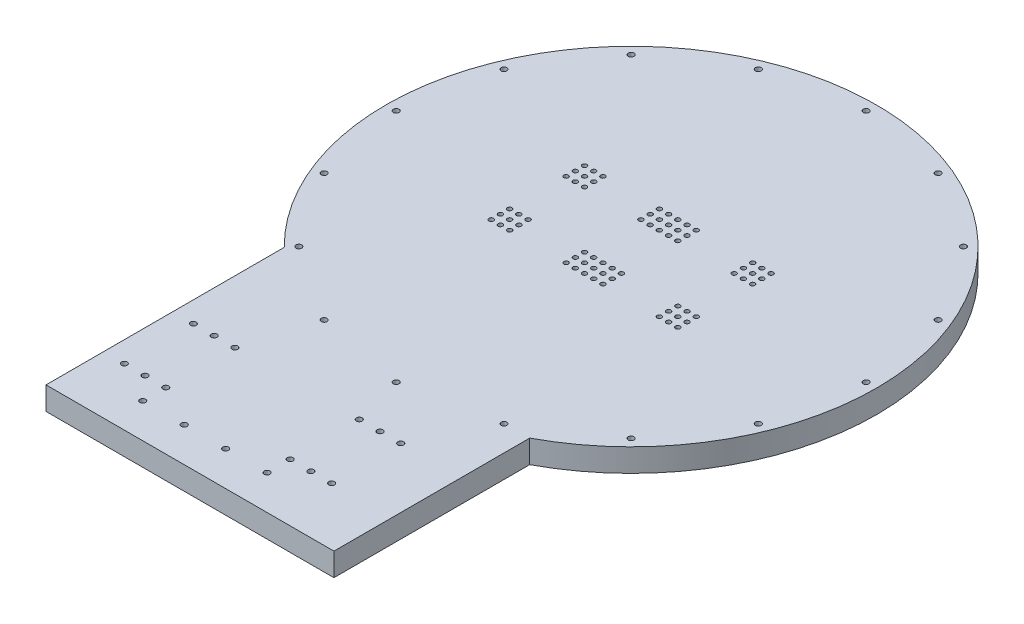
from build123d import *

# Parameters (mm, degrees)
SKETCH_1_R                  = 195
EXTRUDE_1_DEPTH             = 20
HOLE_WIZARD_M4_1_AT_2_COUNT = 2
HOLE_WIZARD_M4_1_AT_2_PITCH = 65
HOLE_WIZARD_M4_1_AT_3_COUNT = 2
HOLE_WIZARD_M4_1_AT_3_PITCH = 91.923881554
HOLE_WIZARD_M4_1_AT_4_COUNT = 2
HOLE_WIZARD_M4_1_AT_4_PITCH = 103.85566908
HOLE_WIZARD_M4_1_AT_5_COUNT = 2
HOLE_WIZARD_M4_1_AT_5_PITCH = 65
HOLE_WIZARD_M4_1_AT_6_COUNT = 2
HOLE_WIZARD_M4_1_AT_6_PITCH = 81
HOLE_WIZARD_M4_1_AT_7_COUNT = 2
HOLE_WIZARD_M4_1_AT_7_PITCH = 146
HOLE_WIZARD_M4_1_AT_8_COUNT = 2
HOLE_WIZARD_M4_1_AT_8_PITCH = 159.815518646
PATTERN_LINEAR_2_COUNT      = 2
PATTERN_LINEAR_2_PITCH      = 8
PATTERN_LINEAR_2_COUNT_DIR2 = 2
PATTERN_LINEAR_2_PITCH_DIR2 = 8
PATTERN_LINEAR_3_COUNT      = 2
PATTERN_LINEAR_3_PITCH      = 8
PATTERN_LINEAR_3_COUNT_DIR2 = 2
PATTERN_LINEAR_3_PITCH_DIR2 = 8
PATTERN_LINEAR_4_COUNT      = 2
PATTERN_LINEAR_4_PITCH      = 8
PATTERN_LINEAR_4_COUNT_DIR2 = 2
PATTERN_LINEAR_4_PITCH_DIR2 = 8
PATTERN_LINEAR_5_COUNT      = 2
PATTERN_LINEAR_5_PITCH      = 8
PATTERN_LINEAR_5_COUNT_DIR2 = 2
PATTERN_LINEAR_5_PITCH_DIR2 = 8
EXTRUDE_START               = -20
SKETCH_3_R                  = 213
SKETCH_3_R_2                = 195
EXTRUDE_2_DEPTH             = 20
EXTRUDE_3_DEPTH             = 20
EXTRUDE_4_DEPTH             = 20
SKETCH_23_W                 = 250
SKETCH_23_H                 = 20
EXTRUDE_5_DEPTH             = 20
HOLE_WIZARD_M6_3_D          = 5
PATTERN_CIRCULAR_2_COUNT    = 16
HOLE_WIZARD_M6_4_D          = 5
PATTERN_LINEAR_7_COUNT      = 2
PATTERN_LINEAR_7_PITCH      = 60
PATTERN_LINEAR_7_COUNT_DIR2 = 2
PATTERN_LINEAR_7_PITCH_DIR2 = 144
HOLE_WIZARD_M6_5_D          = 5
PATTERN_LINEAR_8_COUNT      = 3
PATTERN_LINEAR_8_PITCH      = 36
PATTERN_LINEAR_9_COUNT      = 2
PATTERN_LINEAR_9_PITCH      = 18
PATTERN_LINEAR_9_COPY_1_D   = 5
PATTERN_LINEAR_9_COPY_2_D   = 5
PATTERN_LINEAR_9_COPY_3_D   = 5
PATTERN_LINEAR_10_COUNT     = 2
PATTERN_LINEAR_10_PITCH     = 18
PATTERN_LINEAR_10_COPY_1_D  = 5
PATTERN_LINEAR_10_COPY_2_D  = 5
PATTERN_LINEAR_10_COPY_3_D  = 5
PATTERN_LINEAR_11_COUNT     = 2
PATTERN_LINEAR_11_PITCH     = 36


with BuildPart() as part:
    # 草图1 → 凸台-拉伸1 (new body)
    with BuildSketch(Plane(origin=(0, 0, 0), x_dir=(1, 0, 0), z_dir=(0, 1, 0))):
        with Locations(Location((0, 0, 0), (0, 0, 270))):
            Circle(SKETCH_1_R)
    extrude(amount=EXTRUDE_1_DEPTH)

    # 草图25 → M4 螺纹孔1 (revolve, cut)
    with BuildSketch(Plane(origin=(-73, 20, -32.5), x_dir=(0, 0, 1), z_dir=(1, 0, 0))):
        Polygon((0, 0), (0, 11.201721238), (2, 10), (2, 0), align=None)
    hole_wizard_m4_1 = revolve(axis=Axis((-73, 26.35, -32.5), (0, -1, 0)), mode=Mode.SUBTRACT)

    # M4 螺纹孔1 at 2: M4 螺纹孔1 ×2
    with Locations(*[(0, 0, i * HOLE_WIZARD_M4_1_AT_2_PITCH) for i in range(1, HOLE_WIZARD_M4_1_AT_2_COUNT)]):
        add(hole_wizard_m4_1, mode=Mode.SUBTRACT)

    # M4 螺纹孔1 at 3: M4 螺纹孔1 ×2
    with Locations(*[Vector(0.7071067811865478, 0, 0.7071067811865472) * (i * HOLE_WIZARD_M4_1_AT_3_PITCH) for i in range(1, HOLE_WIZARD_M4_1_AT_3_COUNT)]):
        add(hole_wizard_m4_1, mode=Mode.SUBTRACT)

    # M4 螺纹孔1 at 4: M4 螺纹孔1 ×2
    with Locations(*[Vector(0.7799285365713668, 0, 0.6258685787301087) * (i * HOLE_WIZARD_M4_1_AT_4_PITCH) for i in range(1, HOLE_WIZARD_M4_1_AT_4_COUNT)]):
        add(hole_wizard_m4_1, mode=Mode.SUBTRACT)

    # M4 螺纹孔1 at 5: M4 螺纹孔1 ×2
    with Locations(*[(i * HOLE_WIZARD_M4_1_AT_5_PITCH, 0, 0) for i in range(1, HOLE_WIZARD_M4_1_AT_5_COUNT)]):
        add(hole_wizard_m4_1, mode=Mode.SUBTRACT)

    # M4 螺纹孔1 at 6: M4 螺纹孔1 ×2
    with Locations(*[(i * HOLE_WIZARD_M4_1_AT_6_PITCH, 0, 0) for i in range(1, HOLE_WIZARD_M4_1_AT_6_COUNT)]):
        add(hole_wizard_m4_1, mode=Mode.SUBTRACT)

    # M4 螺纹孔1 at 7: M4 螺纹孔1 ×2
    with Locations(*[(i * HOLE_WIZARD_M4_1_AT_7_PITCH, 0, 0) for i in range(1, HOLE_WIZARD_M4_1_AT_7_COUNT)]):
        add(hole_wizard_m4_1, mode=Mode.SUBTRACT)

    # M4 螺纹孔1 at 8: M4 螺纹孔1 ×2
    with Locations(*[Vector(0.9135533347274932, 0, 0.4067189503923769) * (i * HOLE_WIZARD_M4_1_AT_8_PITCH) for i in range(1, HOLE_WIZARD_M4_1_AT_8_COUNT)]):
        add(hole_wizard_m4_1, mode=Mode.SUBTRACT)

    # 阵列(线性)2: Hole Wizard M4 _1 2 × 2
    with Locations(*[(-i * PATTERN_LINEAR_2_PITCH, 0, j * PATTERN_LINEAR_2_PITCH_DIR2) for i in range(PATTERN_LINEAR_2_COUNT) for j in range(PATTERN_LINEAR_2_COUNT_DIR2) if (i, j) != (0, 0)]):
        add(hole_wizard_m4_1, mode=Mode.SUBTRACT)

    # 阵列(线性)2 copy 1 sketch → 阵列(线性)2 copy 1 (revolve, cut)
    with BuildSketch(Plane(origin=(-73, 20, 40.5), x_dir=(0, 0, 1), z_dir=(1, 0, 0))):
        Polygon((0, 0), (0, 11.201721238), (2, 10), (2, 0), align=None)
    revolve(axis=Axis((-73, 26.35, 40.5), (0, -1, 0)), mode=Mode.SUBTRACT)

    # 阵列(线性)2 copy 2 sketch → 阵列(线性)2 copy 2 (revolve, cut)
    with BuildSketch(Plane(origin=(-81, 20, 32.5), x_dir=(0, 0, 1), z_dir=(1, 0, 0))):
        Polygon((0, 0), (0, 11.201721238), (2, 10), (2, 0), align=None)
    revolve(axis=Axis((-81, 26.35, 32.5), (0, -1, 0)), mode=Mode.SUBTRACT)

    # 阵列(线性)2 copy 3 sketch → 阵列(线性)2 copy 3 (revolve, cut)
    with BuildSketch(Plane(origin=(-81, 20, 40.5), x_dir=(0, 0, 1), z_dir=(1, 0, 0))):
        Polygon((0, 0), (0, 11.201721238), (2, 10), (2, 0), align=None)
    revolve(axis=Axis((-81, 26.35, 40.5), (0, -1, 0)), mode=Mode.SUBTRACT)

    # 阵列(线性)2 copy 4 sketch → 阵列(线性)2 copy 4 (revolve, cut)
    with BuildSketch(Plane(origin=(-8, 20, 40.5), x_dir=(0, 0, 1), z_dir=(1, 0, 0))):
        Polygon((0, 0), (0, 11.201721238), (2, 10), (2, 0), align=None)
    revolve(axis=Axis((-8, 26.35, 40.5), (0, -1, 0)), mode=Mode.SUBTRACT)

    # 阵列(线性)2 copy 5 sketch → 阵列(线性)2 copy 5 (revolve, cut)
    with BuildSketch(Plane(origin=(-16, 20, 32.5), x_dir=(0, 0, 1), z_dir=(1, 0, 0))):
        Polygon((0, 0), (0, 11.201721238), (2, 10), (2, 0), align=None)
    revolve(axis=Axis((-16, 26.35, 32.5), (0, -1, 0)), mode=Mode.SUBTRACT)

    # 阵列(线性)2 copy 6 sketch → 阵列(线性)2 copy 6 (revolve, cut)
    with BuildSketch(Plane(origin=(-16, 20, 40.5), x_dir=(0, 0, 1), z_dir=(1, 0, 0))):
        Polygon((0, 0), (0, 11.201721238), (2, 10), (2, 0), align=None)
    revolve(axis=Axis((-16, 26.35, 40.5), (0, -1, 0)), mode=Mode.SUBTRACT)

    # 阵列(线性)2 copy 7 sketch → 阵列(线性)2 copy 7 (revolve, cut)
    with BuildSketch(Plane(origin=(8, 20, 40.5), x_dir=(0, 0, 1), z_dir=(1, 0, 0))):
        Polygon((0, 0), (0, 11.201721238), (2, 10), (2, 0), align=None)
    revolve(axis=Axis((8, 26.35, 40.5), (0, -1, 0)), mode=Mode.SUBTRACT)

    # 阵列(线性)2 copy 8 sketch → 阵列(线性)2 copy 8 (revolve, cut)
    with BuildSketch(Plane(origin=(0, 20, 32.5), x_dir=(0, 0, 1), z_dir=(1, 0, 0))):
        Polygon((0, 0), (0, 11.201721238), (2, 10), (2, 0), align=None)
    revolve(axis=Axis((0, 26.35, 32.5), (0, -1, 0)), mode=Mode.SUBTRACT)

    # 阵列(线性)2 copy 9 sketch → 阵列(线性)2 copy 9 (revolve, cut)
    with BuildSketch(Plane(origin=(0, 20, 40.5), x_dir=(0, 0, 1), z_dir=(1, 0, 0))):
        Polygon((0, 0), (0, 11.201721238), (2, 10), (2, 0), align=None)
    revolve(axis=Axis((0, 26.35, 40.5), (0, -1, 0)), mode=Mode.SUBTRACT)

    # 阵列(线性)2 copy 10 sketch → 阵列(线性)2 copy 10 (revolve, cut)
    with BuildSketch(Plane(origin=(-8, 20, -24.5), x_dir=(0, 0, 1), z_dir=(1, 0, 0))):
        Polygon((0, 0), (0, 11.201721238), (2, 10), (2, 0), align=None)
    revolve(axis=Axis((-8, 26.35, -24.5), (0, -1, 0)), mode=Mode.SUBTRACT)

    # 阵列(线性)2 copy 11 sketch → 阵列(线性)2 copy 11 (revolve, cut)
    with BuildSketch(Plane(origin=(-16, 20, -32.5), x_dir=(0, 0, 1), z_dir=(1, 0, 0))):
        Polygon((0, 0), (0, 11.201721238), (2, 10), (2, 0), align=None)
    revolve(axis=Axis((-16, 26.35, -32.5), (0, -1, 0)), mode=Mode.SUBTRACT)

    # 阵列(线性)2 copy 12 sketch → 阵列(线性)2 copy 12 (revolve, cut)
    with BuildSketch(Plane(origin=(-16, 20, -24.5), x_dir=(0, 0, 1), z_dir=(1, 0, 0))):
        Polygon((0, 0), (0, 11.201721238), (2, 10), (2, 0), align=None)
    revolve(axis=Axis((-16, 26.35, -24.5), (0, -1, 0)), mode=Mode.SUBTRACT)

    # 阵列(线性)2 copy 13 sketch → 阵列(线性)2 copy 13 (revolve, cut)
    with BuildSketch(Plane(origin=(8, 20, -24.5), x_dir=(0, 0, 1), z_dir=(1, 0, 0))):
        Polygon((0, 0), (0, 11.201721238), (2, 10), (2, 0), align=None)
    revolve(axis=Axis((8, 26.35, -24.5), (0, -1, 0)), mode=Mode.SUBTRACT)

    # 阵列(线性)2 copy 14 sketch → 阵列(线性)2 copy 14 (revolve, cut)
    with BuildSketch(Plane(origin=(0, 20, -32.5), x_dir=(0, 0, 1), z_dir=(1, 0, 0))):
        Polygon((0, 0), (0, 11.201721238), (2, 10), (2, 0), align=None)
    revolve(axis=Axis((0, 26.35, -32.5), (0, -1, 0)), mode=Mode.SUBTRACT)

    # 阵列(线性)2 copy 15 sketch → 阵列(线性)2 copy 15 (revolve, cut)
    with BuildSketch(Plane(origin=(0, 20, -24.5), x_dir=(0, 0, 1), z_dir=(1, 0, 0))):
        Polygon((0, 0), (0, 11.201721238), (2, 10), (2, 0), align=None)
    revolve(axis=Axis((0, 26.35, -24.5), (0, -1, 0)), mode=Mode.SUBTRACT)

    # 阵列(线性)2 copy 16 sketch → 阵列(线性)2 copy 16 (revolve, cut)
    with BuildSketch(Plane(origin=(73, 20, -24.5), x_dir=(0, 0, 1), z_dir=(1, 0, 0))):
        Polygon((0, 0), (0, 11.201721238), (2, 10), (2, 0), align=None)
    revolve(axis=Axis((73, 26.35, -24.5), (0, -1, 0)), mode=Mode.SUBTRACT)

    # 阵列(线性)2 copy 17 sketch → 阵列(线性)2 copy 17 (revolve, cut)
    with BuildSketch(Plane(origin=(65, 20, -32.5), x_dir=(0, 0, 1), z_dir=(1, 0, 0))):
        Polygon((0, 0), (0, 11.201721238), (2, 10), (2, 0), align=None)
    revolve(axis=Axis((65, 26.35, -32.5), (0, -1, 0)), mode=Mode.SUBTRACT)

    # 阵列(线性)2 copy 18 sketch → 阵列(线性)2 copy 18 (revolve, cut)
    with BuildSketch(Plane(origin=(65, 20, -24.5), x_dir=(0, 0, 1), z_dir=(1, 0, 0))):
        Polygon((0, 0), (0, 11.201721238), (2, 10), (2, 0), align=None)
    revolve(axis=Axis((65, 26.35, -24.5), (0, -1, 0)), mode=Mode.SUBTRACT)

    # 阵列(线性)2 copy 19 sketch → 阵列(线性)2 copy 19 (revolve, cut)
    with BuildSketch(Plane(origin=(73, 20, 40.5), x_dir=(0, 0, 1), z_dir=(1, 0, 0))):
        Polygon((0, 0), (0, 11.201721238), (2, 10), (2, 0), align=None)
    revolve(axis=Axis((73, 26.35, 40.5), (0, -1, 0)), mode=Mode.SUBTRACT)

    # 阵列(线性)2 copy 20 sketch → 阵列(线性)2 copy 20 (revolve, cut)
    with BuildSketch(Plane(origin=(65, 20, 32.5), x_dir=(0, 0, 1), z_dir=(1, 0, 0))):
        Polygon((0, 0), (0, 11.201721238), (2, 10), (2, 0), align=None)
    revolve(axis=Axis((65, 26.35, 32.5), (0, -1, 0)), mode=Mode.SUBTRACT)

    # 阵列(线性)2 copy 21 sketch → 阵列(线性)2 copy 21 (revolve, cut)
    with BuildSketch(Plane(origin=(65, 20, 40.5), x_dir=(0, 0, 1), z_dir=(1, 0, 0))):
        Polygon((0, 0), (0, 11.201721238), (2, 10), (2, 0), align=None)
    revolve(axis=Axis((65, 26.35, 40.5), (0, -1, 0)), mode=Mode.SUBTRACT)

    # 阵列(线性)3: Hole Wizard M4 _1 2 × 2
    with Locations(*[(i * PATTERN_LINEAR_3_PITCH, 0, -j * PATTERN_LINEAR_3_PITCH_DIR2) for i in range(PATTERN_LINEAR_3_COUNT) for j in range(PATTERN_LINEAR_3_COUNT_DIR2) if (i, j) != (0, 0)]):
        add(hole_wizard_m4_1, mode=Mode.SUBTRACT)

    # 阵列(线性)3 copy 1 sketch → 阵列(线性)3 copy 1 (revolve, cut)
    with BuildSketch(Plane(origin=(-73, 20, 24.5), x_dir=(0, 0, 1), z_dir=(1, 0, 0))):
        Polygon((0, 0), (0, 11.201721238), (2, 10), (2, 0), align=None)
    revolve(axis=Axis((-73, 26.35, 24.5), (0, -1, 0)), mode=Mode.SUBTRACT)

    # 阵列(线性)3 copy 2 sketch → 阵列(线性)3 copy 2 (revolve, cut)
    with BuildSketch(Plane(origin=(-65, 20, 32.5), x_dir=(0, 0, 1), z_dir=(1, 0, 0))):
        Polygon((0, 0), (0, 11.201721238), (2, 10), (2, 0), align=None)
    revolve(axis=Axis((-65, 26.35, 32.5), (0, -1, 0)), mode=Mode.SUBTRACT)

    # 阵列(线性)3 copy 3 sketch → 阵列(线性)3 copy 3 (revolve, cut)
    with BuildSketch(Plane(origin=(-65, 20, 24.5), x_dir=(0, 0, 1), z_dir=(1, 0, 0))):
        Polygon((0, 0), (0, 11.201721238), (2, 10), (2, 0), align=None)
    revolve(axis=Axis((-65, 26.35, 24.5), (0, -1, 0)), mode=Mode.SUBTRACT)

    # 阵列(线性)3 copy 4 sketch → 阵列(线性)3 copy 4 (revolve, cut)
    with BuildSketch(Plane(origin=(-8, 20, 24.5), x_dir=(0, 0, 1), z_dir=(1, 0, 0))):
        Polygon((0, 0), (0, 11.201721238), (2, 10), (2, 0), align=None)
    revolve(axis=Axis((-8, 26.35, 24.5), (0, -1, 0)), mode=Mode.SUBTRACT)

    # 阵列(线性)3 copy 5 sketch → 阵列(线性)3 copy 5 (revolve, cut)
    with BuildSketch(Plane(origin=(0, 20, 32.5), x_dir=(0, 0, 1), z_dir=(1, 0, 0))):
        Polygon((0, 0), (0, 11.201721238), (2, 10), (2, 0), align=None)
    revolve(axis=Axis((0, 26.35, 32.5), (0, -1, 0)), mode=Mode.SUBTRACT)

    # 阵列(线性)3 copy 6 sketch → 阵列(线性)3 copy 6 (revolve, cut)
    with BuildSketch(Plane(origin=(0, 20, 24.5), x_dir=(0, 0, 1), z_dir=(1, 0, 0))):
        Polygon((0, 0), (0, 11.201721238), (2, 10), (2, 0), align=None)
    revolve(axis=Axis((0, 26.35, 24.5), (0, -1, 0)), mode=Mode.SUBTRACT)

    # 阵列(线性)3 copy 7 sketch → 阵列(线性)3 copy 7 (revolve, cut)
    with BuildSketch(Plane(origin=(8, 20, 24.5), x_dir=(0, 0, 1), z_dir=(1, 0, 0))):
        Polygon((0, 0), (0, 11.201721238), (2, 10), (2, 0), align=None)
    revolve(axis=Axis((8, 26.35, 24.5), (0, -1, 0)), mode=Mode.SUBTRACT)

    # 阵列(线性)3 copy 8 sketch → 阵列(线性)3 copy 8 (revolve, cut)
    with BuildSketch(Plane(origin=(16, 20, 32.5), x_dir=(0, 0, 1), z_dir=(1, 0, 0))):
        Polygon((0, 0), (0, 11.201721238), (2, 10), (2, 0), align=None)
    revolve(axis=Axis((16, 26.35, 32.5), (0, -1, 0)), mode=Mode.SUBTRACT)

    # 阵列(线性)3 copy 9 sketch → 阵列(线性)3 copy 9 (revolve, cut)
    with BuildSketch(Plane(origin=(16, 20, 24.5), x_dir=(0, 0, 1), z_dir=(1, 0, 0))):
        Polygon((0, 0), (0, 11.201721238), (2, 10), (2, 0), align=None)
    revolve(axis=Axis((16, 26.35, 24.5), (0, -1, 0)), mode=Mode.SUBTRACT)

    # 阵列(线性)3 copy 10 sketch → 阵列(线性)3 copy 10 (revolve, cut)
    with BuildSketch(Plane(origin=(-8, 20, -40.5), x_dir=(0, 0, 1), z_dir=(1, 0, 0))):
        Polygon((0, 0), (0, 11.201721238), (2, 10), (2, 0), align=None)
    revolve(axis=Axis((-8, 26.35, -40.5), (0, -1, 0)), mode=Mode.SUBTRACT)

    # 阵列(线性)3 copy 11 sketch → 阵列(线性)3 copy 11 (revolve, cut)
    with BuildSketch(Plane(origin=(0, 20, -32.5), x_dir=(0, 0, 1), z_dir=(1, 0, 0))):
        Polygon((0, 0), (0, 11.201721238), (2, 10), (2, 0), align=None)
    revolve(axis=Axis((0, 26.35, -32.5), (0, -1, 0)), mode=Mode.SUBTRACT)

    # 阵列(线性)3 copy 12 sketch → 阵列(线性)3 copy 12 (revolve, cut)
    with BuildSketch(Plane(origin=(0, 20, -40.5), x_dir=(0, 0, 1), z_dir=(1, 0, 0))):
        Polygon((0, 0), (0, 11.201721238), (2, 10), (2, 0), align=None)
    revolve(axis=Axis((0, 26.35, -40.5), (0, -1, 0)), mode=Mode.SUBTRACT)

    # 阵列(线性)3 copy 13 sketch → 阵列(线性)3 copy 13 (revolve, cut)
    with BuildSketch(Plane(origin=(8, 20, -40.5), x_dir=(0, 0, 1), z_dir=(1, 0, 0))):
        Polygon((0, 0), (0, 11.201721238), (2, 10), (2, 0), align=None)
    revolve(axis=Axis((8, 26.35, -40.5), (0, -1, 0)), mode=Mode.SUBTRACT)

    # 阵列(线性)3 copy 14 sketch → 阵列(线性)3 copy 14 (revolve, cut)
    with BuildSketch(Plane(origin=(16, 20, -32.5), x_dir=(0, 0, 1), z_dir=(1, 0, 0))):
        Polygon((0, 0), (0, 11.201721238), (2, 10), (2, 0), align=None)
    revolve(axis=Axis((16, 26.35, -32.5), (0, -1, 0)), mode=Mode.SUBTRACT)

    # 阵列(线性)3 copy 15 sketch → 阵列(线性)3 copy 15 (revolve, cut)
    with BuildSketch(Plane(origin=(16, 20, -40.5), x_dir=(0, 0, 1), z_dir=(1, 0, 0))):
        Polygon((0, 0), (0, 11.201721238), (2, 10), (2, 0), align=None)
    revolve(axis=Axis((16, 26.35, -40.5), (0, -1, 0)), mode=Mode.SUBTRACT)

    # 阵列(线性)3 copy 16 sketch → 阵列(线性)3 copy 16 (revolve, cut)
    with BuildSketch(Plane(origin=(73, 20, -40.5), x_dir=(0, 0, 1), z_dir=(1, 0, 0))):
        Polygon((0, 0), (0, 11.201721238), (2, 10), (2, 0), align=None)
    revolve(axis=Axis((73, 26.35, -40.5), (0, -1, 0)), mode=Mode.SUBTRACT)

    # 阵列(线性)3 copy 17 sketch → 阵列(线性)3 copy 17 (revolve, cut)
    with BuildSketch(Plane(origin=(81, 20, -32.5), x_dir=(0, 0, 1), z_dir=(1, 0, 0))):
        Polygon((0, 0), (0, 11.201721238), (2, 10), (2, 0), align=None)
    revolve(axis=Axis((81, 26.35, -32.5), (0, -1, 0)), mode=Mode.SUBTRACT)

    # 阵列(线性)3 copy 18 sketch → 阵列(线性)3 copy 18 (revolve, cut)
    with BuildSketch(Plane(origin=(81, 20, -40.5), x_dir=(0, 0, 1), z_dir=(1, 0, 0))):
        Polygon((0, 0), (0, 11.201721238), (2, 10), (2, 0), align=None)
    revolve(axis=Axis((81, 26.35, -40.5), (0, -1, 0)), mode=Mode.SUBTRACT)

    # 阵列(线性)3 copy 19 sketch → 阵列(线性)3 copy 19 (revolve, cut)
    with BuildSketch(Plane(origin=(73, 20, 24.5), x_dir=(0, 0, 1), z_dir=(1, 0, 0))):
        Polygon((0, 0), (0, 11.201721238), (2, 10), (2, 0), align=None)
    revolve(axis=Axis((73, 26.35, 24.5), (0, -1, 0)), mode=Mode.SUBTRACT)

    # 阵列(线性)3 copy 20 sketch → 阵列(线性)3 copy 20 (revolve, cut)
    with BuildSketch(Plane(origin=(81, 20, 32.5), x_dir=(0, 0, 1), z_dir=(1, 0, 0))):
        Polygon((0, 0), (0, 11.201721238), (2, 10), (2, 0), align=None)
    revolve(axis=Axis((81, 26.35, 32.5), (0, -1, 0)), mode=Mode.SUBTRACT)

    # 阵列(线性)3 copy 21 sketch → 阵列(线性)3 copy 21 (revolve, cut)
    with BuildSketch(Plane(origin=(81, 20, 24.5), x_dir=(0, 0, 1), z_dir=(1, 0, 0))):
        Polygon((0, 0), (0, 11.201721238), (2, 10), (2, 0), align=None)
    revolve(axis=Axis((81, 26.35, 24.5), (0, -1, 0)), mode=Mode.SUBTRACT)

    # 阵列(线性)4: Hole Wizard M4 _1 2 × 2
    with Locations(*[(i * PATTERN_LINEAR_4_PITCH, 0, j * PATTERN_LINEAR_4_PITCH_DIR2) for i in range(PATTERN_LINEAR_4_COUNT) for j in range(PATTERN_LINEAR_4_COUNT_DIR2) if (i, j) != (0, 0)]):
        add(hole_wizard_m4_1, mode=Mode.SUBTRACT)

    # 阵列(线性)4 copy 1 sketch → 阵列(线性)4 copy 1 (revolve, cut)
    with BuildSketch(Plane(origin=(-73, 20, 40.5), x_dir=(0, 0, 1), z_dir=(1, 0, 0))):
        Polygon((0, 0), (0, 11.201721238), (2, 10), (2, 0), align=None)
    revolve(axis=Axis((-73, 26.35, 40.5), (0, -1, 0)), mode=Mode.SUBTRACT)

    # 阵列(线性)4 copy 2 sketch → 阵列(线性)4 copy 2 (revolve, cut)
    with BuildSketch(Plane(origin=(-65, 20, 32.5), x_dir=(0, 0, 1), z_dir=(1, 0, 0))):
        Polygon((0, 0), (0, 11.201721238), (2, 10), (2, 0), align=None)
    revolve(axis=Axis((-65, 26.35, 32.5), (0, -1, 0)), mode=Mode.SUBTRACT)

    # 阵列(线性)4 copy 3 sketch → 阵列(线性)4 copy 3 (revolve, cut)
    with BuildSketch(Plane(origin=(-65, 20, 40.5), x_dir=(0, 0, 1), z_dir=(1, 0, 0))):
        Polygon((0, 0), (0, 11.201721238), (2, 10), (2, 0), align=None)
    revolve(axis=Axis((-65, 26.35, 40.5), (0, -1, 0)), mode=Mode.SUBTRACT)

    # 阵列(线性)4 copy 4 sketch → 阵列(线性)4 copy 4 (revolve, cut)
    with BuildSketch(Plane(origin=(-8, 20, 40.5), x_dir=(0, 0, 1), z_dir=(1, 0, 0))):
        Polygon((0, 0), (0, 11.201721238), (2, 10), (2, 0), align=None)
    revolve(axis=Axis((-8, 26.35, 40.5), (0, -1, 0)), mode=Mode.SUBTRACT)

    # 阵列(线性)4 copy 5 sketch → 阵列(线性)4 copy 5 (revolve, cut)
    with BuildSketch(Plane(origin=(0, 20, 32.5), x_dir=(0, 0, 1), z_dir=(1, 0, 0))):
        Polygon((0, 0), (0, 11.201721238), (2, 10), (2, 0), align=None)
    revolve(axis=Axis((0, 26.35, 32.5), (0, -1, 0)), mode=Mode.SUBTRACT)

    # 阵列(线性)4 copy 6 sketch → 阵列(线性)4 copy 6 (revolve, cut)
    with BuildSketch(Plane(origin=(0, 20, 40.5), x_dir=(0, 0, 1), z_dir=(1, 0, 0))):
        Polygon((0, 0), (0, 11.201721238), (2, 10), (2, 0), align=None)
    revolve(axis=Axis((0, 26.35, 40.5), (0, -1, 0)), mode=Mode.SUBTRACT)

    # 阵列(线性)4 copy 7 sketch → 阵列(线性)4 copy 7 (revolve, cut)
    with BuildSketch(Plane(origin=(8, 20, 40.5), x_dir=(0, 0, 1), z_dir=(1, 0, 0))):
        Polygon((0, 0), (0, 11.201721238), (2, 10), (2, 0), align=None)
    revolve(axis=Axis((8, 26.35, 40.5), (0, -1, 0)), mode=Mode.SUBTRACT)

    # 阵列(线性)4 copy 8 sketch → 阵列(线性)4 copy 8 (revolve, cut)
    with BuildSketch(Plane(origin=(16, 20, 32.5), x_dir=(0, 0, 1), z_dir=(1, 0, 0))):
        Polygon((0, 0), (0, 11.201721238), (2, 10), (2, 0), align=None)
    revolve(axis=Axis((16, 26.35, 32.5), (0, -1, 0)), mode=Mode.SUBTRACT)

    # 阵列(线性)4 copy 9 sketch → 阵列(线性)4 copy 9 (revolve, cut)
    with BuildSketch(Plane(origin=(16, 20, 40.5), x_dir=(0, 0, 1), z_dir=(1, 0, 0))):
        Polygon((0, 0), (0, 11.201721238), (2, 10), (2, 0), align=None)
    revolve(axis=Axis((16, 26.35, 40.5), (0, -1, 0)), mode=Mode.SUBTRACT)

    # 阵列(线性)4 copy 10 sketch → 阵列(线性)4 copy 10 (revolve, cut)
    with BuildSketch(Plane(origin=(-8, 20, -24.5), x_dir=(0, 0, 1), z_dir=(1, 0, 0))):
        Polygon((0, 0), (0, 11.201721238), (2, 10), (2, 0), align=None)
    revolve(axis=Axis((-8, 26.35, -24.5), (0, -1, 0)), mode=Mode.SUBTRACT)

    # 阵列(线性)4 copy 11 sketch → 阵列(线性)4 copy 11 (revolve, cut)
    with BuildSketch(Plane(origin=(0, 20, -32.5), x_dir=(0, 0, 1), z_dir=(1, 0, 0))):
        Polygon((0, 0), (0, 11.201721238), (2, 10), (2, 0), align=None)
    revolve(axis=Axis((0, 26.35, -32.5), (0, -1, 0)), mode=Mode.SUBTRACT)

    # 阵列(线性)4 copy 12 sketch → 阵列(线性)4 copy 12 (revolve, cut)
    with BuildSketch(Plane(origin=(0, 20, -24.5), x_dir=(0, 0, 1), z_dir=(1, 0, 0))):
        Polygon((0, 0), (0, 11.201721238), (2, 10), (2, 0), align=None)
    revolve(axis=Axis((0, 26.35, -24.5), (0, -1, 0)), mode=Mode.SUBTRACT)

    # 阵列(线性)4 copy 13 sketch → 阵列(线性)4 copy 13 (revolve, cut)
    with BuildSketch(Plane(origin=(8, 20, -24.5), x_dir=(0, 0, 1), z_dir=(1, 0, 0))):
        Polygon((0, 0), (0, 11.201721238), (2, 10), (2, 0), align=None)
    revolve(axis=Axis((8, 26.35, -24.5), (0, -1, 0)), mode=Mode.SUBTRACT)

    # 阵列(线性)4 copy 14 sketch → 阵列(线性)4 copy 14 (revolve, cut)
    with BuildSketch(Plane(origin=(16, 20, -32.5), x_dir=(0, 0, 1), z_dir=(1, 0, 0))):
        Polygon((0, 0), (0, 11.201721238), (2, 10), (2, 0), align=None)
    revolve(axis=Axis((16, 26.35, -32.5), (0, -1, 0)), mode=Mode.SUBTRACT)

    # 阵列(线性)4 copy 15 sketch → 阵列(线性)4 copy 15 (revolve, cut)
    with BuildSketch(Plane(origin=(16, 20, -24.5), x_dir=(0, 0, 1), z_dir=(1, 0, 0))):
        Polygon((0, 0), (0, 11.201721238), (2, 10), (2, 0), align=None)
    revolve(axis=Axis((16, 26.35, -24.5), (0, -1, 0)), mode=Mode.SUBTRACT)

    # 阵列(线性)4 copy 16 sketch → 阵列(线性)4 copy 16 (revolve, cut)
    with BuildSketch(Plane(origin=(73, 20, -24.5), x_dir=(0, 0, 1), z_dir=(1, 0, 0))):
        Polygon((0, 0), (0, 11.201721238), (2, 10), (2, 0), align=None)
    revolve(axis=Axis((73, 26.35, -24.5), (0, -1, 0)), mode=Mode.SUBTRACT)

    # 阵列(线性)4 copy 17 sketch → 阵列(线性)4 copy 17 (revolve, cut)
    with BuildSketch(Plane(origin=(81, 20, -32.5), x_dir=(0, 0, 1), z_dir=(1, 0, 0))):
        Polygon((0, 0), (0, 11.201721238), (2, 10), (2, 0), align=None)
    revolve(axis=Axis((81, 26.35, -32.5), (0, -1, 0)), mode=Mode.SUBTRACT)

    # 阵列(线性)4 copy 18 sketch → 阵列(线性)4 copy 18 (revolve, cut)
    with BuildSketch(Plane(origin=(81, 20, -24.5), x_dir=(0, 0, 1), z_dir=(1, 0, 0))):
        Polygon((0, 0), (0, 11.201721238), (2, 10), (2, 0), align=None)
    revolve(axis=Axis((81, 26.35, -24.5), (0, -1, 0)), mode=Mode.SUBTRACT)

    # 阵列(线性)4 copy 19 sketch → 阵列(线性)4 copy 19 (revolve, cut)
    with BuildSketch(Plane(origin=(73, 20, 40.5), x_dir=(0, 0, 1), z_dir=(1, 0, 0))):
        Polygon((0, 0), (0, 11.201721238), (2, 10), (2, 0), align=None)
    revolve(axis=Axis((73, 26.35, 40.5), (0, -1, 0)), mode=Mode.SUBTRACT)

    # 阵列(线性)4 copy 20 sketch → 阵列(线性)4 copy 20 (revolve, cut)
    with BuildSketch(Plane(origin=(81, 20, 32.5), x_dir=(0, 0, 1), z_dir=(1, 0, 0))):
        Polygon((0, 0), (0, 11.201721238), (2, 10), (2, 0), align=None)
    revolve(axis=Axis((81, 26.35, 32.5), (0, -1, 0)), mode=Mode.SUBTRACT)

    # 阵列(线性)4 copy 21 sketch → 阵列(线性)4 copy 21 (revolve, cut)
    with BuildSketch(Plane(origin=(81, 20, 40.5), x_dir=(0, 0, 1), z_dir=(1, 0, 0))):
        Polygon((0, 0), (0, 11.201721238), (2, 10), (2, 0), align=None)
    revolve(axis=Axis((81, 26.35, 40.5), (0, -1, 0)), mode=Mode.SUBTRACT)

    # 阵列(线性)5: Hole Wizard M4 _1 2 × 2
    with Locations(*[(-i * PATTERN_LINEAR_5_PITCH, 0, -j * PATTERN_LINEAR_5_PITCH_DIR2) for i in range(PATTERN_LINEAR_5_COUNT) for j in range(PATTERN_LINEAR_5_COUNT_DIR2) if (i, j) != (0, 0)]):
        add(hole_wizard_m4_1, mode=Mode.SUBTRACT)

    # 阵列(线性)5 copy 1 sketch → 阵列(线性)5 copy 1 (revolve, cut)
    with BuildSketch(Plane(origin=(-73, 20, 24.5), x_dir=(0, 0, 1), z_dir=(1, 0, 0))):
        Polygon((0, 0), (0, 11.201721238), (2, 10), (2, 0), align=None)
    revolve(axis=Axis((-73, 26.35, 24.5), (0, -1, 0)), mode=Mode.SUBTRACT)

    # 阵列(线性)5 copy 2 sketch → 阵列(线性)5 copy 2 (revolve, cut)
    with BuildSketch(Plane(origin=(-81, 20, 32.5), x_dir=(0, 0, 1), z_dir=(1, 0, 0))):
        Polygon((0, 0), (0, 11.201721238), (2, 10), (2, 0), align=None)
    revolve(axis=Axis((-81, 26.35, 32.5), (0, -1, 0)), mode=Mode.SUBTRACT)

    # 阵列(线性)5 copy 3 sketch → 阵列(线性)5 copy 3 (revolve, cut)
    with BuildSketch(Plane(origin=(-81, 20, 24.5), x_dir=(0, 0, 1), z_dir=(1, 0, 0))):
        Polygon((0, 0), (0, 11.201721238), (2, 10), (2, 0), align=None)
    revolve(axis=Axis((-81, 26.35, 24.5), (0, -1, 0)), mode=Mode.SUBTRACT)

    # 阵列(线性)5 copy 4 sketch → 阵列(线性)5 copy 4 (revolve, cut)
    with BuildSketch(Plane(origin=(-8, 20, 24.5), x_dir=(0, 0, 1), z_dir=(1, 0, 0))):
        Polygon((0, 0), (0, 11.201721238), (2, 10), (2, 0), align=None)
    revolve(axis=Axis((-8, 26.35, 24.5), (0, -1, 0)), mode=Mode.SUBTRACT)

    # 阵列(线性)5 copy 5 sketch → 阵列(线性)5 copy 5 (revolve, cut)
    with BuildSketch(Plane(origin=(-16, 20, 32.5), x_dir=(0, 0, 1), z_dir=(1, 0, 0))):
        Polygon((0, 0), (0, 11.201721238), (2, 10), (2, 0), align=None)
    revolve(axis=Axis((-16, 26.35, 32.5), (0, -1, 0)), mode=Mode.SUBTRACT)

    # 阵列(线性)5 copy 6 sketch → 阵列(线性)5 copy 6 (revolve, cut)
    with BuildSketch(Plane(origin=(-16, 20, 24.5), x_dir=(0, 0, 1), z_dir=(1, 0, 0))):
        Polygon((0, 0), (0, 11.201721238), (2, 10), (2, 0), align=None)
    revolve(axis=Axis((-16, 26.35, 24.5), (0, -1, 0)), mode=Mode.SUBTRACT)

    # 阵列(线性)5 copy 7 sketch → 阵列(线性)5 copy 7 (revolve, cut)
    with BuildSketch(Plane(origin=(8, 20, 24.5), x_dir=(0, 0, 1), z_dir=(1, 0, 0))):
        Polygon((0, 0), (0, 11.201721238), (2, 10), (2, 0), align=None)
    revolve(axis=Axis((8, 26.35, 24.5), (0, -1, 0)), mode=Mode.SUBTRACT)

    # 阵列(线性)5 copy 8 sketch → 阵列(线性)5 copy 8 (revolve, cut)
    with BuildSketch(Plane(origin=(0, 20, 32.5), x_dir=(0, 0, 1), z_dir=(1, 0, 0))):
        Polygon((0, 0), (0, 11.201721238), (2, 10), (2, 0), align=None)
    revolve(axis=Axis((0, 26.35, 32.5), (0, -1, 0)), mode=Mode.SUBTRACT)

    # 阵列(线性)5 copy 9 sketch → 阵列(线性)5 copy 9 (revolve, cut)
    with BuildSketch(Plane(origin=(0, 20, 24.5), x_dir=(0, 0, 1), z_dir=(1, 0, 0))):
        Polygon((0, 0), (0, 11.201721238), (2, 10), (2, 0), align=None)
    revolve(axis=Axis((0, 26.35, 24.5), (0, -1, 0)), mode=Mode.SUBTRACT)

    # 阵列(线性)5 copy 10 sketch → 阵列(线性)5 copy 10 (revolve, cut)
    with BuildSketch(Plane(origin=(-8, 20, -40.5), x_dir=(0, 0, 1), z_dir=(1, 0, 0))):
        Polygon((0, 0), (0, 11.201721238), (2, 10), (2, 0), align=None)
    revolve(axis=Axis((-8, 26.35, -40.5), (0, -1, 0)), mode=Mode.SUBTRACT)

    # 阵列(线性)5 copy 11 sketch → 阵列(线性)5 copy 11 (revolve, cut)
    with BuildSketch(Plane(origin=(-16, 20, -32.5), x_dir=(0, 0, 1), z_dir=(1, 0, 0))):
        Polygon((0, 0), (0, 11.201721238), (2, 10), (2, 0), align=None)
    revolve(axis=Axis((-16, 26.35, -32.5), (0, -1, 0)), mode=Mode.SUBTRACT)

    # 阵列(线性)5 copy 12 sketch → 阵列(线性)5 copy 12 (revolve, cut)
    with BuildSketch(Plane(origin=(-16, 20, -40.5), x_dir=(0, 0, 1), z_dir=(1, 0, 0))):
        Polygon((0, 0), (0, 11.201721238), (2, 10), (2, 0), align=None)
    revolve(axis=Axis((-16, 26.35, -40.5), (0, -1, 0)), mode=Mode.SUBTRACT)

    # 阵列(线性)5 copy 13 sketch → 阵列(线性)5 copy 13 (revolve, cut)
    with BuildSketch(Plane(origin=(8, 20, -40.5), x_dir=(0, 0, 1), z_dir=(1, 0, 0))):
        Polygon((0, 0), (0, 11.201721238), (2, 10), (2, 0), align=None)
    revolve(axis=Axis((8, 26.35, -40.5), (0, -1, 0)), mode=Mode.SUBTRACT)

    # 阵列(线性)5 copy 14 sketch → 阵列(线性)5 copy 14 (revolve, cut)
    with BuildSketch(Plane(origin=(0, 20, -32.5), x_dir=(0, 0, 1), z_dir=(1, 0, 0))):
        Polygon((0, 0), (0, 11.201721238), (2, 10), (2, 0), align=None)
    revolve(axis=Axis((0, 26.35, -32.5), (0, -1, 0)), mode=Mode.SUBTRACT)

    # 阵列(线性)5 copy 15 sketch → 阵列(线性)5 copy 15 (revolve, cut)
    with BuildSketch(Plane(origin=(0, 20, -40.5), x_dir=(0, 0, 1), z_dir=(1, 0, 0))):
        Polygon((0, 0), (0, 11.201721238), (2, 10), (2, 0), align=None)
    revolve(axis=Axis((0, 26.35, -40.5), (0, -1, 0)), mode=Mode.SUBTRACT)

    # 阵列(线性)5 copy 16 sketch → 阵列(线性)5 copy 16 (revolve, cut)
    with BuildSketch(Plane(origin=(73, 20, -40.5), x_dir=(0, 0, 1), z_dir=(1, 0, 0))):
        Polygon((0, 0), (0, 11.201721238), (2, 10), (2, 0), align=None)
    revolve(axis=Axis((73, 26.35, -40.5), (0, -1, 0)), mode=Mode.SUBTRACT)

    # 阵列(线性)5 copy 17 sketch → 阵列(线性)5 copy 17 (revolve, cut)
    with BuildSketch(Plane(origin=(65, 20, -32.5), x_dir=(0, 0, 1), z_dir=(1, 0, 0))):
        Polygon((0, 0), (0, 11.201721238), (2, 10), (2, 0), align=None)
    revolve(axis=Axis((65, 26.35, -32.5), (0, -1, 0)), mode=Mode.SUBTRACT)

    # 阵列(线性)5 copy 18 sketch → 阵列(线性)5 copy 18 (revolve, cut)
    with BuildSketch(Plane(origin=(65, 20, -40.5), x_dir=(0, 0, 1), z_dir=(1, 0, 0))):
        Polygon((0, 0), (0, 11.201721238), (2, 10), (2, 0), align=None)
    revolve(axis=Axis((65, 26.35, -40.5), (0, -1, 0)), mode=Mode.SUBTRACT)

    # 阵列(线性)5 copy 19 sketch → 阵列(线性)5 copy 19 (revolve, cut)
    with BuildSketch(Plane(origin=(73, 20, 24.5), x_dir=(0, 0, 1), z_dir=(1, 0, 0))):
        Polygon((0, 0), (0, 11.201721238), (2, 10), (2, 0), align=None)
    revolve(axis=Axis((73, 26.35, 24.5), (0, -1, 0)), mode=Mode.SUBTRACT)

    # 阵列(线性)5 copy 20 sketch → 阵列(线性)5 copy 20 (revolve, cut)
    with BuildSketch(Plane(origin=(65, 20, 32.5), x_dir=(0, 0, 1), z_dir=(1, 0, 0))):
        Polygon((0, 0), (0, 11.201721238), (2, 10), (2, 0), align=None)
    revolve(axis=Axis((65, 26.35, 32.5), (0, -1, 0)), mode=Mode.SUBTRACT)

    # 阵列(线性)5 copy 21 sketch → 阵列(线性)5 copy 21 (revolve, cut)
    with BuildSketch(Plane(origin=(65, 20, 24.5), x_dir=(0, 0, 1), z_dir=(1, 0, 0))):
        Polygon((0, 0), (0, 11.201721238), (2, 10), (2, 0), align=None)
    revolve(axis=Axis((65, 26.35, 24.5), (0, -1, 0)), mode=Mode.SUBTRACT)

    # 草图3 → 凸台-拉伸2 (add)
    with BuildSketch(Plane(origin=(0, 20, 0), x_dir=(1, 0, 0), z_dir=(0, 1, 0)).offset(EXTRUDE_START)):
        with Locations(Location((0, 0, 0), (0, 0, 270))):
            Circle(SKETCH_3_R)
        Circle(SKETCH_3_R_2, mode=Mode.SUBTRACT)
    extrude(amount=EXTRUDE_2_DEPTH)

    # 草图9 → 凸台-拉伸3 (add)
    with BuildSketch(Plane.XZ):
        with BuildLine():
            Line((100, 188.066477608), (100, 338.066477608))
            Line((100, 338.066477608), (-100, 338.066477608))
            Line((-100, 338.066477608), (-100, 188.066477608))
            ThreePointArc((-100, 188.066477608), (0, 210.404774427), (100, 188.066477608))
        make_face()
    extrude(amount=-EXTRUDE_3_DEPTH)

    # 草图14 → 凸台-拉伸4 (add)
    with BuildSketch(Plane(origin=(0, 20, 0), x_dir=(1, 0, 0), z_dir=(0, 1, 0))):
        with BuildLine():
            Line((-100, -338.066477608), (-150, -338.066477608))
            Line((-150, -338.066477608), (-150, -151.224997934))
            ThreePointArc((-150, -151.224997934), (-126.222444188, -171.304797341), (-100, -188.066477608))
            Line((-100, -188.066477608), (-100, -338.066477608))
        make_face()
    extrude(amount=-EXTRUDE_4_DEPTH)

    # 草图23 → 凸台-拉伸5 (add)
    with BuildSketch(Plane.XY.offset(338.066477608)):
        with Locations((-25, 10)):
            Rectangle(SKETCH_23_W, SKETCH_23_H)
    extrude(amount=EXTRUDE_5_DEPTH)

    # M6 螺纹孔3 (through all)
    with Locations(Plane(origin=(0, 20, -204), x_dir=(0, 0, 1), z_dir=(0, 1, 0))):
        with Locations((0, 0)):
            hole_wizard_m6_3 = Hole(HOLE_WIZARD_M6_3_D / 2)

    # 阵列(圆周)2: M6 螺纹孔3 ×16 about axis
    pattern_circular_2_axis = Axis((0, 0, 0), (0, 1, 0))
    for i in range(1, PATTERN_CIRCULAR_2_COUNT):
        add(hole_wizard_m6_3.rotate(pattern_circular_2_axis, i * 360 / PATTERN_CIRCULAR_2_COUNT), mode=Mode.SUBTRACT)

    # M6 螺纹孔4 (through all)
    with Locations(Plane(origin=(-114, 20, 308.066477608), x_dir=(0, 0, 1), z_dir=(0, 1, 0))):
        with Locations((0, 0)):
            hole_wizard_m6_4 = Hole(HOLE_WIZARD_M6_4_D / 2)

    # 阵列(线性)7: Hole Wizard M6 _4 2 × 2
    with Locations(*[(j * PATTERN_LINEAR_7_PITCH_DIR2, 0, -i * PATTERN_LINEAR_7_PITCH) for i in range(PATTERN_LINEAR_7_COUNT) for j in range(PATTERN_LINEAR_7_COUNT_DIR2) if (i, j) != (0, 0)]):
        add(hole_wizard_m6_4, mode=Mode.SUBTRACT)

    # M6 螺纹孔5 (through all)
    with Locations(Plane(origin=(-60, 20, 328.066477608), x_dir=(0, 0, 1), z_dir=(0, 1, 0))):
        with Locations((0, 0)):
            hole_wizard_m6_5 = Hole(HOLE_WIZARD_M6_5_D / 2)

    # 阵列(线性)8: M6 螺纹孔5 ×3
    with Locations(*[(i * PATTERN_LINEAR_8_PITCH, 0, 0) for i in range(1, PATTERN_LINEAR_8_COUNT)]):
        add(hole_wizard_m6_5, mode=Mode.SUBTRACT)

    # 阵列(线性)9: M6 螺纹孔4 ×2
    with Locations(*[(i * PATTERN_LINEAR_9_PITCH, 0, 0) for i in range(1, PATTERN_LINEAR_9_COUNT)]):
        add(hole_wizard_m6_4, mode=Mode.SUBTRACT)

    # 阵列(线性)9 copy 1 (through all)
    with Locations(Plane(origin=(48, 20, 308.066477608), x_dir=(0, 0, 1), z_dir=(0, 1, 0))):
        with Locations((0, 0)):
            Hole(PATTERN_LINEAR_9_COPY_1_D / 2)

    # 阵列(线性)9 copy 2 (through all)
    with Locations(Plane(origin=(-96, 20, 248.066477608), x_dir=(0, 0, 1), z_dir=(0, 1, 0))):
        with Locations((0, 0)):
            Hole(PATTERN_LINEAR_9_COPY_2_D / 2)

    # 阵列(线性)9 copy 3 (through all)
    with Locations(Plane(origin=(48, 20, 248.066477608), x_dir=(0, 0, 1), z_dir=(0, 1, 0))):
        with Locations((0, 0)):
            Hole(PATTERN_LINEAR_9_COPY_3_D / 2)

    # 阵列(线性)10: M6 螺纹孔4 ×2
    with Locations(*[(-i * PATTERN_LINEAR_10_PITCH, 0, 0) for i in range(1, PATTERN_LINEAR_10_COUNT)]):
        add(hole_wizard_m6_4, mode=Mode.SUBTRACT)

    # 阵列(线性)10 copy 1 (through all)
    with Locations(Plane(origin=(12, 20, 308.066477608), x_dir=(0, 0, 1), z_dir=(0, 1, 0))):
        with Locations((0, 0)):
            Hole(PATTERN_LINEAR_10_COPY_1_D / 2)

    # 阵列(线性)10 copy 2 (through all)
    with Locations(Plane(origin=(-132, 20, 248.066477608), x_dir=(0, 0, 1), z_dir=(0, 1, 0))):
        with Locations((0, 0)):
            Hole(PATTERN_LINEAR_10_COPY_2_D / 2)

    # 阵列(线性)10 copy 3 (through all)
    with Locations(Plane(origin=(12, 20, 248.066477608), x_dir=(0, 0, 1), z_dir=(0, 1, 0))):
        with Locations((0, 0)):
            Hole(PATTERN_LINEAR_10_COPY_3_D / 2)

    # 阵列(线性)11: M6 螺纹孔5 ×2
    with Locations(*[(-i * PATTERN_LINEAR_11_PITCH, 0, 0) for i in range(1, PATTERN_LINEAR_11_COUNT)]):
        add(hole_wizard_m6_5, mode=Mode.SUBTRACT)


solid = part.part
